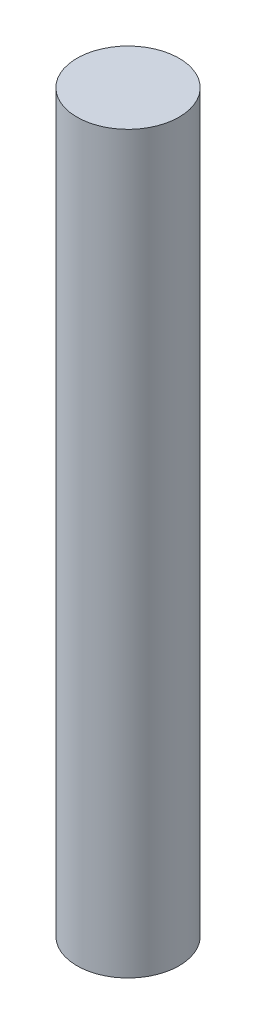
from build123d import *

# Parameters (mm, degrees)
ESBO_O1_W = 1.5
ESBO_O1_H = 21.6


with BuildPart() as part:
    # Esboço1 → Revolução1 (revolve)
    with BuildSketch(Plane.XY):
        with Locations((0.75, 10.8)):
            Rectangle(ESBO_O1_W, ESBO_O1_H)
    revolve(axis=Axis((0, 0, 0), (0, 1, 0)))


solid = part.part
